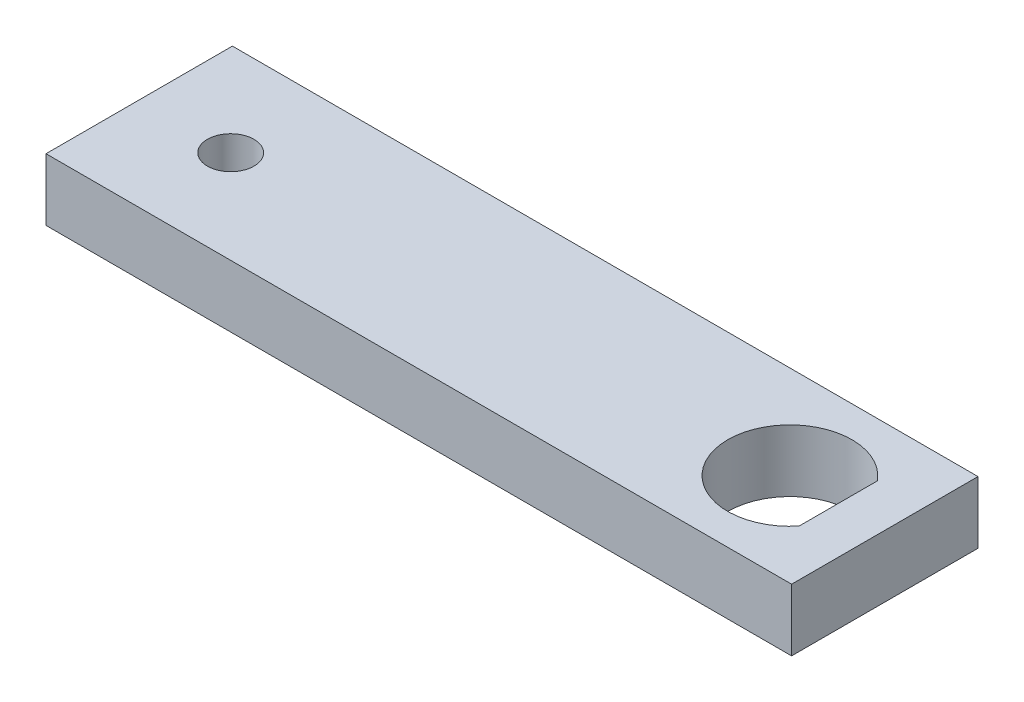
from build123d import *

# Parameters (mm, degrees)
SKETCH1_W           = 76.2
SKETCH1_H           = 19.05
SKETCH1_R           = 2.38
BOSS_EXTRUDE1_DEPTH = 6.35


with BuildPart() as part:
    # Sketch1 → Boss-Extrude1 (new body)
    with BuildSketch(Plane(origin=(0, 0, 0), x_dir=(1, 0, 0), z_dir=(0, 1, 0))):
        Rectangle(SKETCH1_W, SKETCH1_H)
        with Locations(Location((-28.75, 0, 0), (0, 0, 270))):
            Circle(SKETCH1_R, mode=Mode.SUBTRACT)
        with BuildLine():
            Line((33.34, 3.989849621), (33.34, -3.989849621))
            ThreePointArc((33.34, -3.989849621), (22.05, 0), (33.34, 3.989849621))
        make_face(mode=Mode.SUBTRACT)
    extrude(amount=BOSS_EXTRUDE1_DEPTH)


solid = part.part
